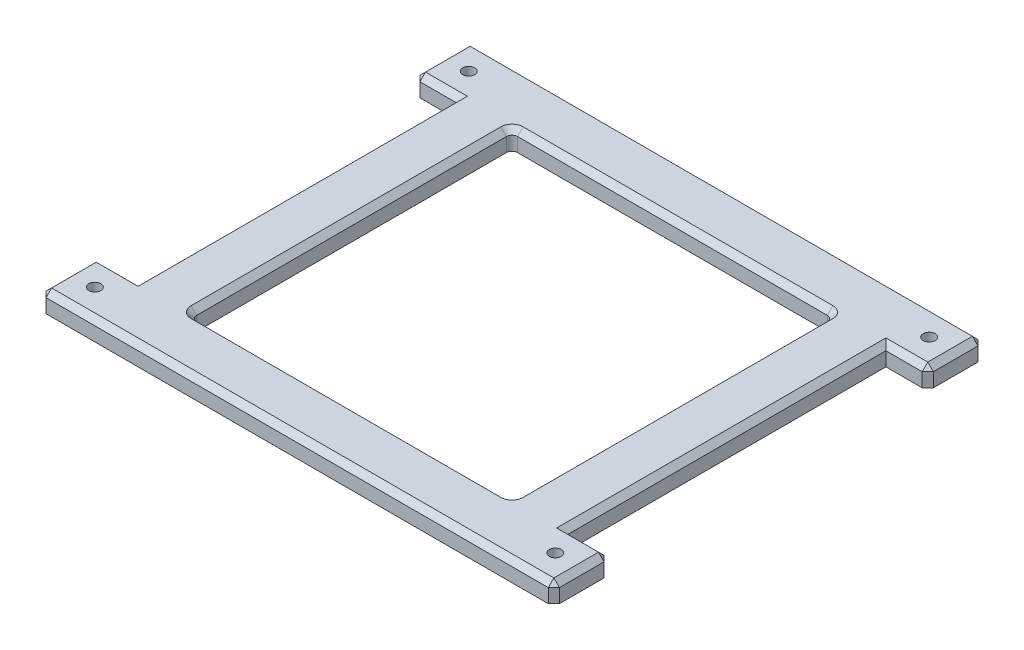
from build123d import *

# Parameters (mm, degrees)
SKETCH_1_W               = 154
SKETCH_1_H               = 154
EXTRUDE_1_DEPTH          = 7
SKETCH_7_W               = 10.6
SKETCH_7_H               = 5.6
CUT_EXTRUDE_2_DEPTH      = 2
SKETCH_8_W               = 115
SKETCH_8_H               = 115
CUT_EXTRUDE_3_DEPTH      = 110.119200877
SKETCH_11_W              = 20
SKETCH_11_H              = 7
EXTRUDE_6_DEPTH          = 15
MIRROR_6_COPY_1_SKETCH_W = 20
MIRROR_6_COPY_1_SKETCH_H = 7
MIRROR_6_COPY_1_DEPTH    = 15
FILLET_6_R               = 2
CHAMFER_5_SIZE           = 2
HOLE_WIZARD_M31_D        = 3.15
SKETCH_14_R              = 2.15
CUT_EXTRUDE_4_DEPTH      = 5


with BuildPart() as part:
    # Эскиз1 → Бобышка-Вытянуть1 (new body)
    with BuildSketch(Plane(origin=(0, 0, 0), x_dir=(1, 0, 0), z_dir=(0, 1, 0))):
        Rectangle(SKETCH_1_W, SKETCH_1_H)
    extrude(amount=EXTRUDE_1_DEPTH)

    # Эскиз7 → Вырез-Вытянуть2 (cut)
    with BuildSketch(Plane.XZ):
        with Locations((-67.25, 67.25)):
            Rectangle(SKETCH_7_W, SKETCH_7_H)
        with Locations((67.25, 67.25)):
            Rectangle(SKETCH_7_W, SKETCH_7_H)
        with Locations((-67.25, -67.25)):
            Rectangle(SKETCH_7_W, SKETCH_7_H)
        with Locations((67.25, -67.25)):
            Rectangle(SKETCH_7_W, SKETCH_7_H)
    extrude(amount=-CUT_EXTRUDE_2_DEPTH, mode=Mode.SUBTRACT)

    # Эскиз8 → Вырез-Вытянуть3 (cut, through all)
    with BuildSketch(Plane(origin=(0, 7, 0), x_dir=(1, 0, 0), z_dir=(0, 1, 0))):
        Rectangle(SKETCH_8_W, SKETCH_8_H)
    extrude(amount=-CUT_EXTRUDE_3_DEPTH, mode=Mode.SUBTRACT)

    # Эскиз11 → Бобышка-Вытянуть6 (add)
    with BuildSketch(Plane(origin=(77, 0, 0), x_dir=(0, 0, -1), z_dir=(1, 0, 0))):
        with Locations((-67, 3.5)):
            Rectangle(SKETCH_11_W, SKETCH_11_H)
    extrude_6 = extrude(amount=EXTRUDE_6_DEPTH)

    # Зеркальное отражение5: Бобышка-Вытянуть6 across plane
    add(extrude_6.mirror(Plane.XY))

    # Зеркальное отражение6: Бобышка-Вытянуть6 across plane
    add(extrude_6.mirror(Plane(origin=(0, 0, 0), x_dir=(0, 0, 1), z_dir=(1, 0, 0))))

    # Зеркальное отражение6 copy 1 sketch → Зеркальное отражение6 copy 1 (add)
    with BuildSketch(Plane.ZY.offset(77)):
        with Locations((-67, 3.5)):
            Rectangle(MIRROR_6_COPY_1_SKETCH_W, MIRROR_6_COPY_1_SKETCH_H)
    extrude(amount=MIRROR_6_COPY_1_DEPTH)

    # Скругление6
    fillet_6_edges = [part.edges().sort_by_distance(p)[0] for p in [
        (57.5, 3.5, -57.5),
        (57.5, 3.5, 57.5),
        (-57.5, 3.5, 57.5),
        (-57.5, 3.5, -57.5),
    ]]
    fillet(fillet_6_edges, radius=FILLET_6_R)

    # Chamfer 5
    chamfer_5_edges = [part.edges().sort_by_distance(p)[0] for p in [
        (-92, 3.5, 77),
        (-92, 7, 67),
        (-92, 3.5, 57),
        (-84.5, 7, 57),
        (-77, 7, 0),
        (-84.5, 7, -57),
        (-92, 3.5, -57),
        (-92, 7, -67),
        (-92, 3.5, -77),
        (0, 7, -57.5),
        (57.5, 7, 0),
        (0, 7, 57.5),
        (-57.5, 7, 0),
        (56.914213562, 7, -56.914213562),
        (56.914213562, 7, 56.914213562),
        (-56.914213562, 7, -56.914213562),
        (-56.914213562, 7, 56.914213562),
        (0, 7, 77),
        (77, 7, 0),
        (84.5, 7, 57),
        (92, 3.5, 57),
        (92, 7, 67),
        (92, 3.5, 77),
        (0, 7, -77),
        (92, 3.5, -77),
        (92, 7, -67),
        (92, 3.5, -57),
        (84.5, 7, -57),
    ]]
    chamfer(chamfer_5_edges, length=CHAMFER_5_SIZE)

    # Сверло под метчик  спиральное M31 (through all)
    with Locations(Plane(origin=(0, 7, 0), x_dir=(1, 0, 0), z_dir=(0, 1, 0))):
        with Locations((82.5, -67), (-82.5, 67), (82.5, 67), (-82.5, -67)):
            Hole(HOLE_WIZARD_M31_D / 2)

    # Эскиз14 → Вырез-Вытянуть4 (cut)
    with BuildSketch(Plane(origin=(0, 7, 0), x_dir=(1, 0, 0), z_dir=(0, 1, 0))):
        with Locations(Location((-82.5, 67, 0), (0, 0, 270))):
            Circle(SKETCH_14_R)
        with Locations(Location((82.5, 67, 0), (0, 0, 270))):
            Circle(SKETCH_14_R)
        with Locations(Location((-82.5, -67, 0), (0, 0, 270))):
            Circle(SKETCH_14_R)
        with Locations(Location((82.5, -67, 0), (0, 0, 270))):
            Circle(SKETCH_14_R)
    extrude(amount=-CUT_EXTRUDE_4_DEPTH, mode=Mode.SUBTRACT)


solid = part.part
